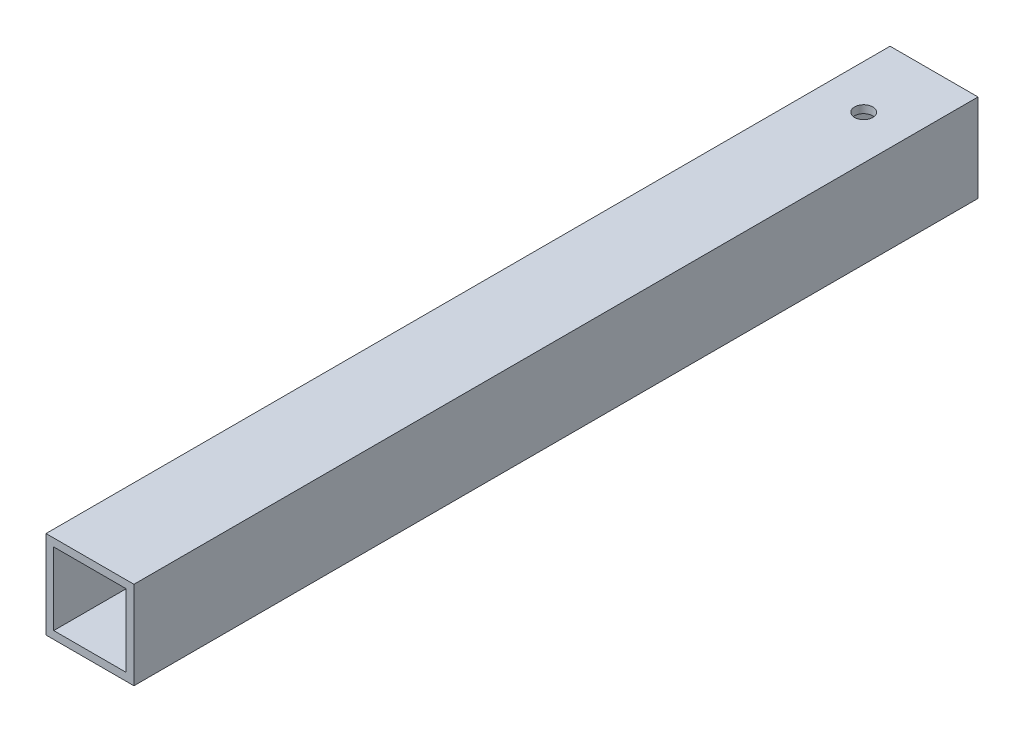
from build123d import *

# Parameters (mm, degrees)
SKETCH1_W           = 31.75
SKETCH1_H           = 31.75
SKETCH1_W_2         = 26.162
SKETCH1_H_2         = 26.162
BOSS_EXTRUDE1_DEPTH = 304.8
SKETCH2_R           = 3.302
CUT_EXTRUDE1_DEPTH  = 307.860095361


with BuildPart() as part:
    # Sketch1 → Boss-Extrude1 (new body)
    with BuildSketch(Plane.XY):
        Rectangle(SKETCH1_W, SKETCH1_H)
        Rectangle(SKETCH1_W_2, SKETCH1_H_2, mode=Mode.SUBTRACT)
    extrude(amount=BOSS_EXTRUDE1_DEPTH)

    # Sketch2 → Cut-Extrude1 (cut, through all)
    with BuildSketch(Plane(origin=(0, 15.875, 0), x_dir=(1, 0, 0), z_dir=(0, 1, 0))):
        with Locations(Location((0, -25.4, 0), (0, 0, 180))):
            Circle(SKETCH2_R)
    extrude(amount=-CUT_EXTRUDE1_DEPTH, mode=Mode.SUBTRACT)


solid = part.part
